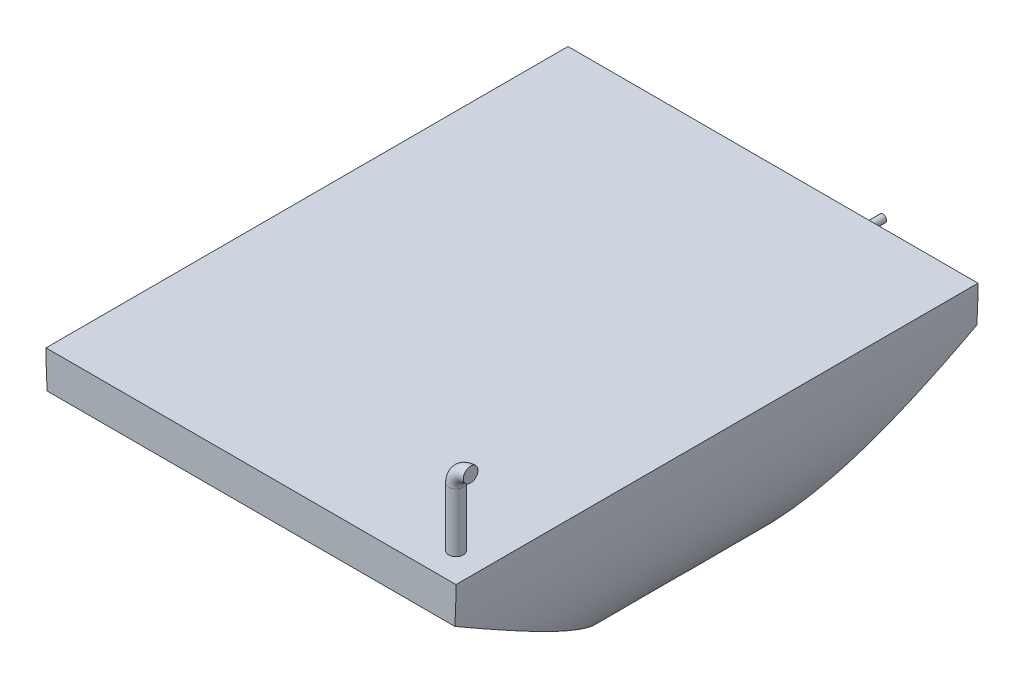
from build123d import *

# Parameters (mm, degrees)
BOSS_EXTRUDE1_DEPTH      = 452.12
BOSS_EXTRUDE1_DEPTH_BACK = 452.12
SPLIT1_SURFACE_1_BACK    = 1193.92
SPLIT1_SURFACE_1_DEPTH   = 2387.84
SPLIT1_SURFACE_2_BACK    = 1193.92
SPLIT1_SURFACE_2_DEPTH   = 2387.84
SPLIT2_SURFACE_3_BACK    = 1193.92
SPLIT2_SURFACE_3_DEPTH   = 2387.84
SWEEP2_PROFILE_R         = 12.7
SWEEP3_PROFILE_R         = 6.35


with BuildPart() as part:
    # Sketch1 → Boss-Extrude1 (new, two sides: drawn at the far end of the back side and taken through both)
    with BuildSketch(Plane.XY.offset(-BOSS_EXTRUDE1_DEPTH_BACK)):
        with BuildLine():
            Line((-355.107031778, 317.813001305), (355.107031778, 317.813001305))
            add(Edge.make_bspline(
                [(355.107031778, 317.813001305), (355.107031778, 0), (0, 0)],
                knots=[0, 0, 0, 1, 1, 1], degree=2, weights=[1, 1.445610253, 1]))
            add(Edge.make_bspline(
                [(-355.107031778, 317.813001305), (-355.107031778, 0), (0, 0)],
                knots=[0, 0, 0, 1, 1, 1], degree=2, weights=[1, 1.445610253, 1]))
        make_face()
    extrude(amount=BOSS_EXTRUDE1_DEPTH + BOSS_EXTRUDE1_DEPTH_BACK)


with BuildPart() as body_2:
    # Split1: the piece behind the surface
    add(part.part)
    # Split1 surface: a surface, the sketch's curves swept straight by 2387.84 mm
    with BuildLine(Plane.XY.offset(-SPLIT1_SURFACE_1_BACK), mode=Mode.PRIVATE) as split1_surface_1_path:
        Line((-375.613705312, 254), (390.111595474, 254))
    split1_surface_1 = Shell.extrude(split1_surface_1_path.wire(), (0 * SPLIT1_SURFACE_1_DEPTH, 0 * SPLIT1_SURFACE_1_DEPTH, 1 * SPLIT1_SURFACE_1_DEPTH))
    split(bisect_by=split1_surface_1, keep=Keep.BOTTOM)

    # Split2: cut with a surface, the side behind it stays
    # Split2 surface: a surface, the sketch's curves swept straight by 2387.84 mm
    with BuildLine(Plane(origin=(0, 0, 0), x_dir=(0, 0, -1), z_dir=(1, 0, 0)).offset(-SPLIT2_SURFACE_3_BACK), mode=Mode.PRIVATE) as split2_surface_3_path:
        Line((452.12, 254), (25.4, -1.4429e-05))
        Line((25.4, -1.4429e-05), (0, 0))
        Line((0, 0), (-25.4, -1.4429e-05))
        Line((-25.4, -1.4429e-05), (-452.12, 254))
    split2_surface_3 = Shell.extrude(split2_surface_3_path.wire(), (1 * SPLIT2_SURFACE_3_DEPTH, 0 * SPLIT2_SURFACE_3_DEPTH, 0 * SPLIT2_SURFACE_3_DEPTH))
    split(bisect_by=split2_surface_3, keep=Keep.BOTTOM)


with BuildPart() as part_1:
    add(part.part)

    # Split1: split by a surface, the side it looks to stays
    # Split1 surface: a surface, the sketch's curves swept straight by 2387.84 mm
    with BuildLine(Plane.XY.offset(-SPLIT1_SURFACE_2_BACK), mode=Mode.PRIVATE) as split1_surface_2_path:
        Line((-375.613705312, 254), (390.111595474, 254))
    split1_surface_2 = Shell.extrude(split1_surface_2_path.wire(), (0 * SPLIT1_SURFACE_2_DEPTH, 0 * SPLIT1_SURFACE_2_DEPTH, 1 * SPLIT1_SURFACE_2_DEPTH))
    split(bisect_by=split1_surface_2, keep=Keep.TOP)

    # Combine1: union body 2
    add(body_2.part)

    # Sweep2: sweep along a path in Sketch11
    with BuildLine(Plane.XY.offset(401.32)) as sweep2_path:
        Line((304.307031778, 317.813001305), (304.307031778, 419.413001305))
        ThreePointArc((304.307031778, 419.413001305), (311.746519536, 437.373513547), (329.707031778, 444.813001305))
    # Sweep2 profile (on start of the path) → Sweep2 (sweep)
    with BuildSketch(Plane(origin=(304.307031778, 317.813001305, 401.32), x_dir=(0, 0, 1), z_dir=(0, 1, 0))):
        Circle(SWEEP2_PROFILE_R)
    sweep(path=sweep2_path.line)

    # Sweep3: sweep along a path in Sketch29
    with BuildLine(Plane(origin=(0, 0, 0), x_dir=(0, 0, -1), z_dir=(1, 0, 0))) as sweep3_path:
        Line((0, 7.936698782), (74.967450517, 7.936698782))
        Line((74.967450517, 7.936698782), (308.779136536, 142.493092911))
        Line((308.779136536, 142.493092911), (642.461424741, 142.493092911))
    # Sweep3 profile (on start of the path) → Sweep3 (sweep)
    with BuildSketch(Plane(origin=(0, 7.936698782, 0), x_dir=(-1, 0, 0), z_dir=(0, 0, -1))):
        Circle(SWEEP3_PROFILE_R)
    sweep(path=sweep3_path.line, transition=Transition.RIGHT)


solid = part_1.part
